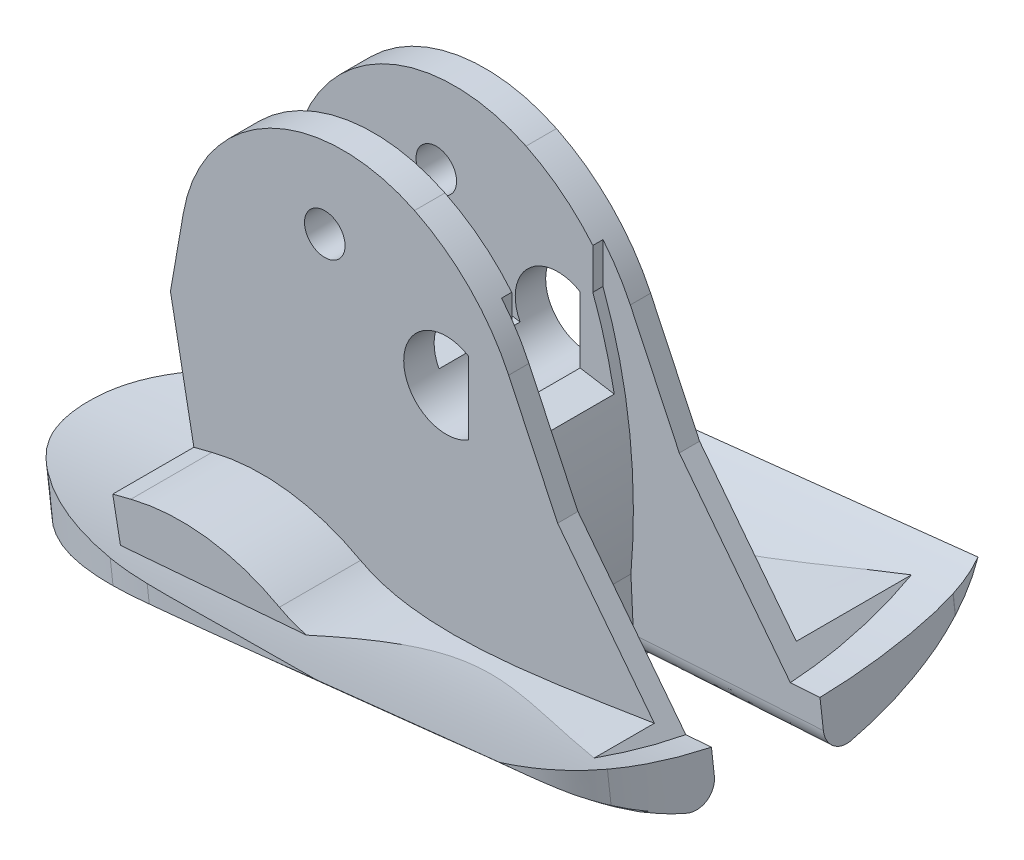
from build123d import *

# Parameters (mm, degrees)
SKETCH10_R                = 1
BOSS_EXTRUDE5_DEPTH       = 7.5
CUT_EXTRUDE1_DEPTH        = 4
FILLET1_R                 = 10
CUT_EXTRUDE6_START        = -11
CUT_EXTRUDE6_DEPTH        = 10
CUT_EXTRUDE7_DEPTH        = 2
BOSS_EXTRUDE11_DEPTH      = 9
CUT_EXTRUDE9_DEPTH        = 9
FILLET2_R                 = 8
FILLET3_R                 = 10
BOSS_EXTRUDE15_DEPTH      = 2
BOSS_EXTRUDE16_DEPTH      = 50
BOSS_EXTRUDE16_DEPTH_BACK = 10
CUT_EXTRUDE10_DEPTH       = 72
CUT_EXTRUDE10_DEPTH_BACK  = 30
SKETCH35_R                = 55.402587586
CUT_EXTRUDE11_DEPTH       = 35
CUT_EXTRUDE11_DEPTH_BACK  = 10
CUT_EXTRUDE13_DEPTH       = 2.5
FILLET4_R                 = 1


with BuildPart() as part:
    # Sketch10 → Boss-Extrude5 (new, symmetric)
    with BuildSketch(Plane.XY):
        Polygon((24.800982713, 46.206909386), (29.373769335, 36.52146178), (36.993816658, 26.682834617), (12.788755024, 23.658848526), (10.279677841, 36.875809012), (12.321789019, 48.656944563), align=None)
        with Locations((17.890076876, 43.12952492)):
            Circle(SKETCH10_R, mode=Mode.SUBTRACT)
        with BuildLine():
            Line((24.982298789, 39.668364252), (24.982298789, 41.457218634))
            ThreePointArc((24.982298789, 41.457218634), (21.782298789, 39.668364252), (24.982298789, 37.87950987))
            Line((24.982298789, 37.87950987), (24.982298789, 39.668364252))
        make_face(mode=Mode.SUBTRACT)
    extrude(amount=BOSS_EXTRUDE5_DEPTH, both=True)

    # Sketch11 → Cut-Extrude1 (cut)
    with BuildSketch(Plane.XY.offset(7.5)):
        with BuildLine():
            Line((17.825431655, 32.423947427), (9.123881611, 30.207909529))
            Line((9.123881611, 30.207909529), (6.594316119, 53.15991455))
            Line((6.594316119, 53.15991455), (34.693470887, 60.271659822))
            Line((34.693470887, 60.271659822), (37.752907488, 30.846026516))
            add(Edge.make_bspline(
                [(37.752907488, 30.846026516), (30.679137573, 30.15507536), (19.269012528, 26.734198276), (17.825431655, 32.423947427)],
                knots=[0, 0, 0, 0, 1, 1, 1, 1], degree=3))
        make_face()
    extrude(amount=-CUT_EXTRUDE1_DEPTH, mode=Mode.SUBTRACT)

    # Fillet1
    fillet1_edges = [part.edges().sort_by_distance(p)[0] for p in [
        (24.800982713, 46.206909386, -2),
    ]]
    fillet(fillet1_edges, radius=FILLET1_R)

    # Sketch11<2> → Cut-Extrude6 (cut)
    with BuildSketch(Plane.XY.offset(7.5).offset(CUT_EXTRUDE6_START)):
        with BuildLine():
            Line((17.825431655, 32.423947427), (9.123881611, 30.207909529))
            Line((9.123881611, 30.207909529), (6.594316119, 53.15991455))
            Line((6.594316119, 53.15991455), (34.693470887, 60.271659822))
            Line((34.693470887, 60.271659822), (37.752907488, 30.846026516))
            add(Edge.make_bspline(
                [(37.752907488, 30.846026516), (30.679137573, 30.15507536), (19.269012528, 26.734198276), (17.825431655, 32.423947427)],
                knots=[0, 0, 0, 0, 1, 1, 1, 1], degree=3))
        make_face()
    extrude(amount=-CUT_EXTRUDE6_DEPTH, mode=Mode.SUBTRACT)

    # Sketch16 → Cut-Extrude7 (cut, symmetric)
    with BuildSketch(Plane.XY):
        Polygon((10.074284509, 54.36084815), (34.418624568, 54.36084815), (34.418624568, 36.664364271), (10.074284509, 40.645108775), align=None)
    extrude(amount=CUT_EXTRUDE7_DEPTH, both=True, mode=Mode.SUBTRACT)

    # Sketch26 → Boss-Extrude11 (add)
    with BuildSketch(Plane(origin=(36.040611594, 27.913565719, 0), x_dir=(0, 0, -1), z_dir=(0.7906052239960584, 0.6123262037428601, 0))):
        Polygon((3.5, 10.887729805), (-3.5, 10.887729805), (-3.5, 3.097750314), (-7.5, 3.097750314), (-7.5, -1.556694877), (7.5, -1.556694877), (7.5, 3.097750314), (3.5, 3.097750314), align=None)
    extrude(amount=BOSS_EXTRUDE11_DEPTH)

    # Sketch32 → Cut-Extrude9 (cut)
    with BuildSketch(Plane(origin=(43.156058609, 33.424501552, 0), x_dir=(0, 0, -1), z_dir=(0.7906052239960583, 0.6123262037428603, 0))):
        Polygon((3.5, 10.887729805), (-3.5, 10.887729805), (-3.5, 3.097750314), (-7.5, 3.097750314), (-7.5, -1.556694877), (7.5, -1.556694877), (7.5, 3.097750314), (3.5, 3.097750314), align=None)
    extrude(amount=-CUT_EXTRUDE9_DEPTH, mode=Mode.SUBTRACT)

    # Fillet2
    fillet2_edges = [part.edges().sort_by_distance(p)[0] for p in [
        (12.321789019, 48.656944563, 2.75),
        (12.321789019, 48.656944563, -2.75),
    ]]
    fillet(fillet2_edges, radius=FILLET2_R)

    # Fillet3
    fillet3_edges = [part.edges().sort_by_distance(p)[0] for p in [
        (17.825431655, 32.423947427, 5.5),
        (17.825431655, 32.423947427, -5.5),
    ]]
    fillet(fillet3_edges, radius=FILLET3_R)

    # Sketch33 → Boss-Extrude15 (add)
    with BuildSketch(Plane(origin=(0, 0, -7.5), x_dir=(-1, 0, 0), z_dir=(0, 0, -1))):
        with BuildLine():
            Line((-12.788755024, 23.658848526), (-11.433819556, 30.796185182))
            Line((-11.433819556, 30.796185182), (-12.326379112, 31.023494775))
            ThreePointArc((-12.326379112, 31.023494775), (-16.080268918, 31.249787506), (-19.652288318, 30.073533078))
            add(Edge.make_bspline(
                [(-19.652288318, 30.073533078), (-22.736081617, 28.359604072), (-28.881324174, 29.544383842), (-34.143777904, 30.362663299)],
                knots=[0.191604014, 0.191604014, 0.191604014, 0.191604014, 0.842502128, 0.842502128, 0.842502128, 0.842502128], degree=3))
            Line((-34.143777904, 30.362663299), (-36.993816658, 26.682834617))
            Line((-36.993816658, 26.682834617), (-12.788755024, 23.658848526))
        make_face()
    extrude(amount=BOSS_EXTRUDE15_DEPTH)

    # Sketch34 → Boss-Extrude16 (add, two sides: drawn at the far end of the back side and taken through both)
    with BuildSketch(Plane(origin=(36.597192761, 26.906452385, -1.160255626), x_dir=(0.04321821705497575, 0.003059083284290857, 0.9990609729761487), z_dir=(-0.9965676258845166, -0.07053931359849483, 0.0433263462104898)).offset(-BOSS_EXTRUDE16_DEPTH_BACK)):
        with BuildLine():
            add(Edge.make_bspline(
                [(10.962786318, 4.622239084), (3.477027295, -2.408718941), (-3.521324785, -0.251063561), (-6.924030749, 1.436687227), (-9.80602641, 4.145717831)],
                knots=[0, 0, 0, 0, 0, 1, 1, 1, 1, 1], degree=4))
            add(Edge.make_bspline(
                [(10.962786318, 4.622239084), (5.102895066, 2.718145103), (1.095664304, 2.097978438), (-5.296822865, 2.527324591), (-9.80602641, 4.145717831)],
                knots=[0, 0, 0, 0, 0, 1, 1, 1, 1, 1], degree=4))
        make_face()
    extrude(amount=BOSS_EXTRUDE16_DEPTH + BOSS_EXTRUDE16_DEPTH_BACK)

    # Sketch35 → Cut-Extrude10 (cut, two sides: drawn at the far end of the back side and taken through both)
    with BuildSketch(Plane(origin=(-2.713783032, 21.72208587, 0), x_dir=(0.9922861825342592, 0.12396826993867012, 0), z_dir=(0.12396826993867012, -0.9922861825342592, 0)).offset(-CUT_EXTRUDE10_DEPTH_BACK)):
        with Locations((27.392722065, -0.627909345)):
            Circle(SKETCH35_R)
        with BuildLine():
            Line((39.612352512, -9.273588573), (39.614007802, -9.258869605))
            add(Edge.make_bspline(
                [(39.614007802, -9.258869605), (39.678830946, -8.678837107), (39.70351823, -8.072212932), (39.729849907, -6.806621918), (39.731133165, -6.143176432), (39.72807294, -4.796526143), (39.722243082, -4.110775413), (39.707188448, -3.063444166), (39.70097799, -2.711206892), (39.68347428, -2.000348716), (39.671823767, -1.640404861), (39.624420663, -0.569092492), (39.578570516, 0.138484587), (39.466763781, 1.541625381), (39.400759424, 2.238979443), (39.243197791, 3.613640689), (39.153160573, 4.278350971), (38.929984455, 5.562418423), (38.797859709, 6.181847542), (38.615779874, 6.77517355)],
                knots=[0, 0, 0, 0, 0.125, 0.125, 0.25, 0.25, 0.375, 0.375, 0.4375, 0.4375, 0.5, 0.5, 0.625, 0.625, 0.75, 0.75, 0.875, 0.875, 1, 1, 1, 1], degree=3))
            add(Edge.make_bspline(
                [(38.615779874, 6.77517355), (38.487920813, 7.191815545), (38.333560113, 7.586691965), (37.958116521, 8.333189293), (37.742711303, 8.689343865), (37.348477305, 9.165011041), (37.204538088, 9.314261632), (36.892817511, 9.596204225), (36.724465126, 9.729564062), (36.358337391, 9.974042405), (36.163506297, 10.082653847), (35.744263752, 10.269001922), (35.516776676, 10.347060586), (35.046252401, 10.469389366), (34.804345648, 10.514410719), (34.310984083, 10.581957019), (34.058566841, 10.604456086), (33.30742604, 10.647747866), (32.808915952, 10.64625525), (31.813939695, 10.615189938), (31.31752463, 10.584883628), (30.325753881, 10.508681123), (29.830412067, 10.462595811), (29.335320346, 10.41230934)],
                knots=[0, 0, 0, 0, 0.125, 0.125, 0.25, 0.25, 0.3125, 0.3125, 0.375, 0.375, 0.4375, 0.4375, 0.5, 0.5, 0.5625, 0.5625, 0.625, 0.625, 0.75, 0.75, 0.875, 0.875, 1, 1, 1, 1], degree=3))
            add(Edge.make_bspline(
                [(29.335320346, 10.41230934), (28.420686227, 10.319409945), (27.508389025, 10.213312798), (25.682320102, 10.002702576), (24.768587706, 9.89776067), (22.938362135, 9.69895626), (22.021810483, 9.605894719), (20.646978682, 9.463874306), (20.188746807, 9.415803906), (19.273568304, 9.311327474), (18.816693548, 9.25505134), (18.361962746, 9.187148629)],
                knots=[0, 0, 0, 0, 0.25, 0.25, 0.5, 0.5, 0.75, 0.75, 0.875, 0.875, 1, 1, 1, 1], degree=3))
            add(Edge.make_bspline(
                [(18.361962746, 9.187148629), (17.956199827, 9.126558051), (17.55346239, 9.056587652), (16.759171766, 8.881516247), (16.368089203, 8.774935449), (15.981024819, 8.65459847)],
                knots=[0, 0, 0, 0, 0.5, 0.5, 1, 1, 1, 1], degree=3))
            add(Edge.make_bspline(
                [(15.981024819, 8.65459847), (15.290402348, 8.43988633), (14.615504895, 8.188315656), (13.292937001, 7.628145556), (12.64504143, 7.315324561), (11.386117969, 6.626616127), (10.773630282, 6.248191555), (9.889978023, 5.627415008), (9.601636398, 5.411867492), (9.039664085, 4.960251351), (8.765702036, 4.724581942), (8.503254923, 4.473381337)],
                knots=[0, 0, 0, 0, 0.25, 0.25, 0.5, 0.5, 0.75, 0.75, 0.875, 0.875, 1, 1, 1, 1], degree=3))
            add(Edge.make_bspline(
                [(8.503254923, 4.473381337), (8.217366265, 4.199743714), (7.949758166, 3.911635473), (7.473919955, 3.289205771), (7.265335012, 2.955137609), (7.094666539, 2.591128146)],
                knots=[0, 0, 0, 0, 0.5, 0.5, 1, 1, 1, 1], degree=3))
            add(Edge.make_bspline(
                [(7.094666539, 2.591128146), (6.960583341, 2.305149418), (6.853233951, 2.007539952), (6.697211007, 1.402457797), (6.64717371, 1.093308783), (6.604945996, 0.461257959), (6.613959482, 0.144805472), (6.691974824, -0.474257497), (6.761652403, -0.779078241), (6.867186396, -1.078514879)],
                knots=[0, 0, 0, 0, 0.25, 0.25, 0.5, 0.5, 0.75, 0.75, 1, 1, 1, 1], degree=3))
            add(Edge.make_bspline(
                [(6.867186396, -1.078514879), (6.933493626, -1.266651548), (7.01345076, -1.45015825), (7.194634668, -1.800930835), (7.295732392, -1.968596045), (7.625324321, -2.452356741), (7.879822883, -2.749451198), (8.153607635, -3.03224787)],
                knots=[0, 0, 0, 0, 0.25, 0.25, 0.5, 0.5, 1, 1, 1, 1], degree=3))
            add(Edge.make_bspline(
                [(8.153607635, -3.03224787), (8.404302614, -3.291194744), (8.667243367, -3.534314337), (9.206562411, -4.002452402), (9.483315343, -4.227023415), (10.329574137, -4.879019484), (10.915949297, -5.285664484), (12.117322846, -6.049861689), (12.730934725, -6.408159085), (13.978582566, -7.087726179), (14.611573332, -7.409145334), (15.252755396, -7.713303907)],
                knots=[0, 0, 0, 0, 0.125, 0.125, 0.25, 0.25, 0.5, 0.5, 0.75, 0.75, 1, 1, 1, 1], degree=3))
            add(Edge.make_bspline(
                [(15.252755396, -7.713303907), (15.86877354, -8.005525431), (16.492212255, -8.278590671), (17.771769247, -8.756513617), (18.425851357, -8.965515171), (19.087300383, -9.15912614)],
                knots=[0, 0, 0, 0, 0.5, 0.5, 1, 1, 1, 1], degree=3))
            add(Edge.make_bspline(
                [(19.087300383, -9.15912614), (20.058137345, -9.443297222), (21.039859229, -9.695391439), (22.999868491, -10.201988455), (23.979488745, -10.452823481), (24.956502389, -10.705877336)],
                knots=[0, 0, 0, 0, 0.5, 0.5, 1, 1, 1, 1], degree=3))
            add(Edge.make_bspline(
                [(24.956502389, -10.705877336), (25.521222033, -10.852143956), (26.085137459, -10.998809958), (27.212752038, -11.289646307), (27.776310477, -11.434097641), (28.342251215, -11.571931792)],
                knots=[0, 0, 0, 0, 0.5, 0.5, 1, 1, 1, 1], degree=3))
            add(Edge.make_bspline(
                [(28.342251215, -11.571931792), (29.351914607, -11.817834034), (30.370480744, -12.040953623), (32.441968076, -12.372764474), (33.491309427, -12.481919508), (34.541668096, -12.564489847)],
                knots=[0, 0, 0, 0, 0.5, 0.5, 1, 1, 1, 1], degree=3))
            add(Edge.make_bspline(
                [(34.541668096, -12.564489847), (34.827957124, -12.586995476), (35.114243751, -12.607613895), (35.686800238, -12.641216663), (35.973070266, -12.654439328), (36.545572859, -12.664271489), (36.831466903, -12.661664717), (37.249817974, -12.624365087), (37.388988008, -12.605761099), (37.653254672, -12.54985343), (37.778152113, -12.512470828), (37.894664133, -12.463755626)],
                knots=[0, 0, 0, 0, 0.25, 0.25, 0.5, 0.5, 0.75, 0.75, 0.875, 0.875, 1, 1, 1, 1], degree=3))
            add(Edge.make_bspline(
                [(37.894664133, -12.463755626), (37.976109988, -12.429702048), (38.051946409, -12.39100221), (38.123616577, -12.348656129)],
                knots=[0, 0, 0, 0, 1, 1, 1, 1], degree=3))
            add(Edge.make_bspline(
                [(38.123616577, -12.348656129), (38.262401642, -12.266655434), (38.383818423, -12.172079191), (38.600694294, -11.968787379), (38.695730198, -11.860444538), (38.953701251, -11.519211595), (39.090701699, -11.268081663), (39.311292558, -10.740757161), (39.396324815, -10.464469902), (39.498585094, -10.032138729), (39.525513364, -9.88445278), (39.573735272, -9.583427039), (39.594649145, -9.430016289), (39.612352512, -9.273588573)],
                knots=[0, 0, 0, 0, 0.125, 0.125, 0.25, 0.25, 0.5, 0.5, 0.75, 0.75, 0.875, 0.875, 1, 1, 1, 1], degree=3))
        make_face(mode=Mode.SUBTRACT)
    extrude(amount=CUT_EXTRUDE10_DEPTH + CUT_EXTRUDE10_DEPTH_BACK, mode=Mode.SUBTRACT)

    # Sketch36 → Cut-Extrude11 (cut, two sides: drawn at the far end of the back side and taken through both)
    with BuildSketch(Plane(origin=(36.597192761, 26.906452385, -1.160255626), x_dir=(0.04321821705497575, 0.003059083284290857, 0.9990609729761487), z_dir=(-0.9965676258845166, -0.07053931359849483, 0.0433263462104898)).offset(-CUT_EXTRUDE11_DEPTH_BACK)):
        with BuildLine():
            Line((-11.629437705, 6.127401317), (-10.836764357, -5.045897527))
            Line((-10.836764357, -5.045897527), (4.676891988, -6.772500476))
            Line((4.676891988, -6.772500476), (13.026434605, -2.468878201))
            Line((13.026434605, -2.468878201), (11.841552256, 5.534498248))
            add(Edge.make_bspline(
                [(-11.629437705, 6.127401317), (-6.430667289, -1.000085375), (3.087976812, -1.746160943), (7.225611875, 0.894114509), (11.841552256, 5.534498248)],
                knots=[0, 0, 0, 0, 0, 1, 1, 1, 1, 1], degree=4))
        make_face()
    extrude(amount=CUT_EXTRUDE11_DEPTH + CUT_EXTRUDE11_DEPTH_BACK, mode=Mode.SUBTRACT)

    # Sketch38 → Cut-Extrude13 (cut, symmetric)
    with BuildSketch(Plane.XY):
        with BuildLine():
            Line((25.610790382, 47.784392592), (25.610790382, 41.753407195))
            add(Edge.make_bspline(
                [(25.610790382, 41.753407195), (27.534154842, 36.606564082), (26.987597253, 30.159272712)],
                knots=[0, 0, 0, 1, 1, 1], degree=2))
            Line((26.987597253, 30.159272712), (27.418107076, 21.424973651))
            Line((27.418107076, 21.424973651), (39.921059833, 21.424973651))
            Line((39.921059833, 21.424973651), (37.073040227, 47.784392592))
            Line((37.073040227, 47.784392592), (25.610790382, 47.784392592))
        make_face()
    extrude(amount=CUT_EXTRUDE13_DEPTH, both=True, mode=Mode.SUBTRACT)

    # Fillet4
    fillet4_edges = [part.edges().sort_by_distance(p)[0] for p in [
        (31.717406541, 26.901141956, 2.5),
        (31.850594129, 26.733162449, -2.5),
    ]]
    fillet(fillet4_edges, radius=FILLET4_R)


solid = part.part
